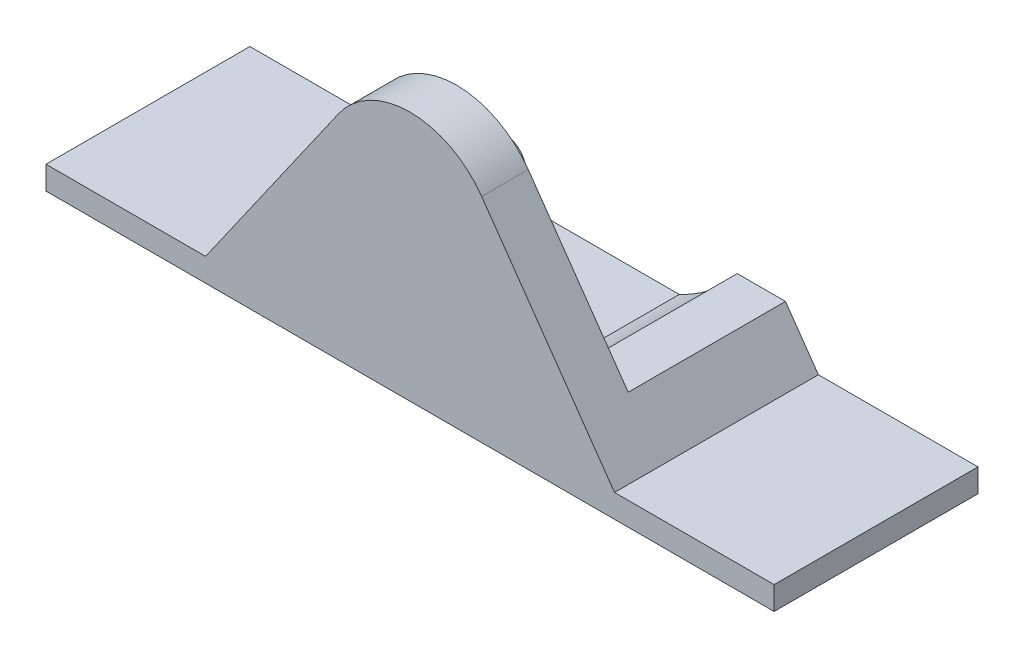
from build123d import *

# Parameters (mm, degrees)
SKETCH1_W           = 125
SKETCH1_H           = 35
BOSS_EXTRUDE1_DEPTH = 4
BOSS_EXTRUDE2_DEPTH = 8
SKETCH4_R           = 6
BOSS_EXTRUDE3_DEPTH = 1
SKETCH5_R           = 3.95
BOSS_EXTRUDE4_DEPTH = 7
BOSS_EXTRUDE5_DEPTH = 27


with BuildPart() as part:
    # Sketch1 → Boss-Extrude1 (new body)
    with BuildSketch(Plane(origin=(0, 0, 0), x_dir=(1, 0, 0), z_dir=(0, 1, 0))):
        with Locations((62.5, 17.5)):
            Rectangle(SKETCH1_W, SKETCH1_H)
    extrude(amount=BOSS_EXTRUDE1_DEPTH)

    # Sketch3 → Boss-Extrude2 (add)
    with BuildSketch(Plane.XY):
        with BuildLine():
            Line((50.210098614, 36.599902553), (27.398199936, 4))
            Line((27.398199936, 4), (97.601800064, 4))
            Line((97.601800064, 4), (74.789901386, 36.599902553))
            ThreePointArc((74.789901386, 36.599902553), (62.5, 43), (50.210098614, 36.599902553))
        make_face()
    extrude(amount=-BOSS_EXTRUDE2_DEPTH)

    # Sketch4 → Boss-Extrude3 (add)
    with BuildSketch(Plane(origin=(0, 0, -8), x_dir=(-1, 0, 0), z_dir=(0, 0, -1))):
        with Locations(Location((-62.5, 28, 0), (0, 0, 180))):
            Circle(SKETCH4_R)
    extrude(amount=BOSS_EXTRUDE3_DEPTH)

    # Sketch5 → Boss-Extrude4 (add)
    with BuildSketch(Plane(origin=(0, 0, -9), x_dir=(-1, 0, 0), z_dir=(0, 0, -1))):
        with Locations((-62.5, 28)):
            Circle(SKETCH5_R)
    extrude(amount=BOSS_EXTRUDE4_DEPTH)

    # Sketch8 → Boss-Extrude5 (add)
    with BuildSketch(Plane(origin=(0, 0, -8), x_dir=(-1, 0, 0), z_dir=(0, 0, -1))):
        with BuildLine():
            Line((-51.277701451, 4), (-27.398199936, 4))
            Line((-27.398199936, 4), (-33.049223109, 12.07573308))
            Line((-33.049223109, 12.07573308), (-41.325541145, 12.07573308))
            ThreePointArc((-41.325541145, 12.07573308), (-45.805934025, 7.427004448), (-51.277701451, 4))
        make_face()
        with BuildLine():
            Line((-91.950776891, 12.07573308), (-83.674458855, 12.07573308))
            ThreePointArc((-83.674458855, 12.07573308), (-79.194065975, 7.427004448), (-73.722298549, 4))
            Line((-73.722298549, 4), (-97.601800064, 4))
            Line((-97.601800064, 4), (-91.950776891, 12.07573308))
        make_face()
    extrude(amount=BOSS_EXTRUDE5_DEPTH)


solid = part.part
